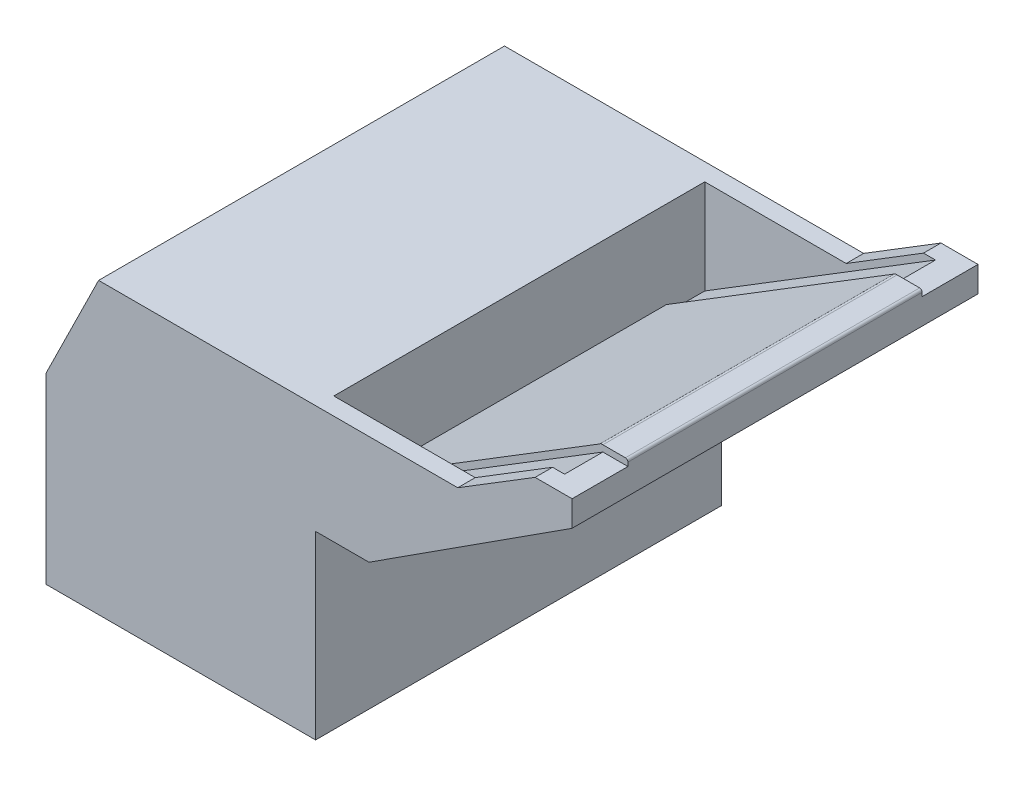
from build123d import *

# Parameters (mm, degrees)
BOSS_EXTRUDE1_DEPTH = 3050
CUT_EXTRUDE1_START  = -50
CUT_EXTRUDE1_DEPTH  = 2950
BOSS_EXTRUDE2_DEPTH = 50
BOSS_EXTRUDE3_DEPTH = 89
BOSS_EXTRUDE4_START = 3050
BOSS_EXTRUDE4_DEPTH = 89
SKETCH6_W           = 199.092278188
SKETCH6_H           = 2340
BOSS_EXTRUDE5_DEPTH = 50
BOSS_EXTRUDE6_START = -2340
BOSS_EXTRUDE6_DEPTH = 2340
FILLET1_R           = 20


with BuildPart() as part:
    # Sketch2 → Boss-Extrude1 (new body)
    with BuildSketch(Plane.XY):
        Polygon((1737.345937977, 48.712659876), (1737.345937977, 1466.578582035), (2162.053208937, 1466.578582035), (3777.248237729, 2507.94563346), (3777.248237729, 2711.398673289), (3482.833143325, 2711.398673289), (2867.862215589, 2332.520799884), (1755.887579039, 2332.520799884), (11.564226404, 2332.520799884), (-406.757702546, 1483.943756902), (-406.757702546, 29.917591817), (1737.345937977, 29.917591817), align=None)
    extrude(amount=BOSS_EXTRUDE1_DEPTH)

    # Sketch3 → Cut-Extrude1 (cut)
    with BuildSketch(Plane.XY.offset(3050).offset(CUT_EXTRUDE1_START)):
        Polygon((1743.280769525, 1580.949120956), (1743.280769525, 2332.520799884), (2867.862215589, 2332.520799884), (3482.833143325, 2711.398673289), (3578.155959541, 2711.398673289), align=None)
    extrude(amount=-CUT_EXTRUDE1_DEPTH, mode=Mode.SUBTRACT)

    # Sketch5 → Boss-Extrude2 (add)
    with BuildSketch(Plane(origin=(-226.386043362, 367.455702445, 0), x_dir=(0.8513898766435084, 0.5245333906901939, 0), z_dir=(-0.5245333906901939, 0.8513898766435084, 0))):
        Polygon((2707.696643339, -355), (4468.624900618, -355), (4468.624900618, -2695), (2707.696643339, -2695), (2313.472202244, -2695), (2313.472202244, -355), align=None)
    extrude(amount=BOSS_EXTRUDE2_DEPTH)

    # Sketch2<2> → Boss-Extrude3 (add)
    with BuildSketch(Plane.XY):
        Polygon((1737.345937977, 48.712659876), (1737.345937977, 1466.578582035), (2162.053208937, 1466.578582035), (3777.248237729, 2507.94563346), (3777.248237729, 2711.398673289), (3482.833143325, 2711.398673289), (2867.862215589, 2332.520799884), (1755.887579039, 2332.520799884), (11.564226404, 2332.520799884), (-406.757702546, 1483.943756902), (-406.757702546, 29.917591817), (1737.345937977, 29.917591817), align=None)
    extrude(amount=-BOSS_EXTRUDE3_DEPTH)

    # Sketch2<3> → Boss-Extrude4 (add)
    with BuildSketch(Plane.XY.offset(BOSS_EXTRUDE4_START)):
        Polygon((1737.345937977, 48.712659876), (1737.345937977, 1466.578582035), (2162.053208937, 1466.578582035), (3777.248237729, 2507.94563346), (3777.248237729, 2711.398673289), (3482.833143325, 2711.398673289), (2867.862215589, 2332.520799884), (1755.887579039, 2332.520799884), (11.564226404, 2332.520799884), (-406.757702546, 1483.943756902), (-406.757702546, 29.917591817), (1737.345937977, 29.917591817), align=None)
    extrude(amount=BOSS_EXTRUDE4_DEPTH)

    # Sketch6 → Boss-Extrude5 (add)
    with BuildSketch(Plane(origin=(0, 2711.398673289, 0), x_dir=(1, 0, 0), z_dir=(0, 1, 0))):
        with Locations((3677.702098635, -1525)):
            Rectangle(SKETCH6_W, SKETCH6_H)
    extrude(amount=BOSS_EXTRUDE5_DEPTH)

    # Sketch7 → Boss-Extrude6 (add)
    with BuildSketch(Plane.XY.offset(2695).offset(BOSS_EXTRUDE6_START)):
        with BuildLine():
            Line((3551.929290006, 2753.968167121), (3578.155959541, 2711.398673289))
            Line((3578.155959541, 2711.398673289), (3578.155959541, 2761.398673289))
            ThreePointArc((3578.155959541, 2761.398673289), (3563.990024064, 2761.398673289), (3551.929290006, 2753.968167121))
        make_face()
    extrude(amount=BOSS_EXTRUDE6_DEPTH)

    # Fillet1
    fillet1_edges = [part.edges().sort_by_distance(p)[0] for p in [
        (3777.248237729, 2761.398673289, 1525),
    ]]
    fillet(fillet1_edges, radius=FILLET1_R)


solid = part.part
